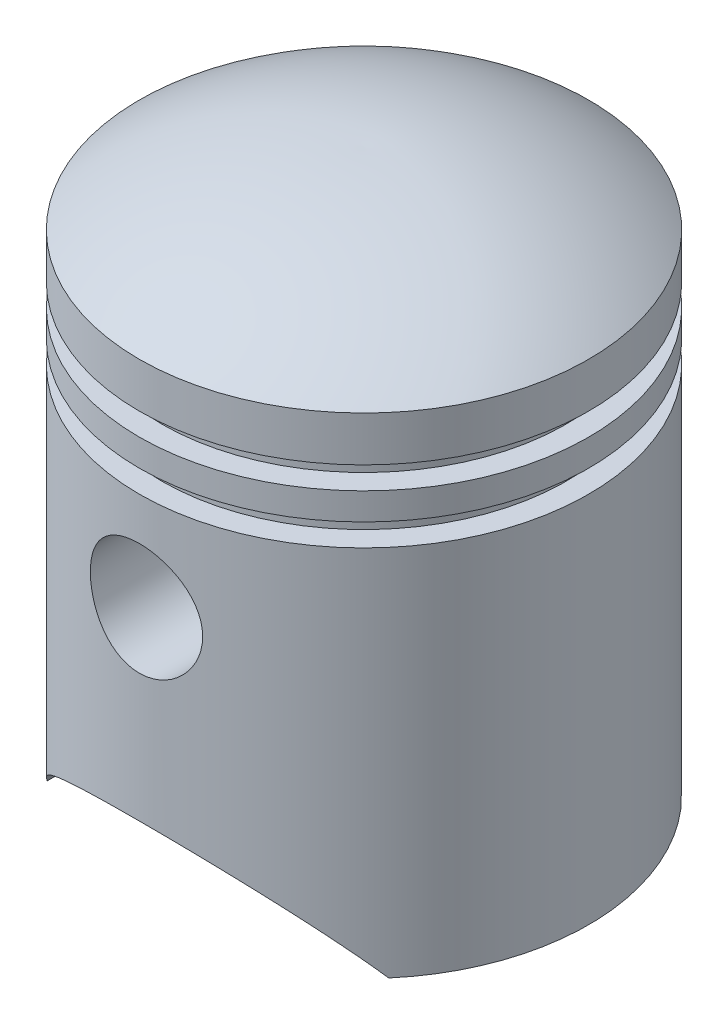
from build123d import *

# Parameters (mm, degrees)
CUT_EXTRUDE1_DEPTH       = 72.817566835
CUT_EXTRUDE1_DEPTH_BACK  = 72.817566835
SKETCH2_R                = 6.25
BOSS_EXTRUDE2_REACH      = 85.818
BOSS_EXTRUDE2_END_RADIUS = 23
BOSS_EXTRUDE2_START      = 12
SKETCH3_R                = 7.25
SKETCH3_R_2              = 6.25


with BuildPart() as part:
    # Sketch1 → Revolve1 (revolve)
    with BuildSketch(Plane.XY, mode=Mode.PRIVATE) as revolve1_sk:
        with BuildLine():
            Line((25, 0), (25, 41.5))
            Line((25, 41.5), (22.5, 41.5))
            Line((22.5, 41.5), (22.5, 44))
            Line((22.5, 44), (25, 44))
            Line((25, 44), (25, 47))
            Line((25, 47), (22.5, 47))
            Line((22.5, 47), (22.5, 49.5))
            Line((22.5, 49.5), (25, 49.5))
            Line((25, 49.5), (25, 54.5))
            ThreePointArc((25, 54.5), (13.174901691, 60.609067785), (0, 62.5))
            Line((0, 62.5), (0, 60.49936285))
            ThreePointArc((0, 60.49936285), (12.069492637, 58.859165445), (23, 53.484511145))
            Line((23, 53.484511145), (23, 51.5))
            Line((23, 51.5), (20.5, 51.5))
            Line((20.5, 51.5), (20.5, 45.5))
            Line((20.5, 45.5), (20.5, 39.5))
            Line((20.5, 39.5), (23, 39.5))
            Line((23, 39.5), (23, 0))
            Line((23, 0), (25, 0))
        make_face()
    revolve(revolve1_sk.sketch.rotate(Axis((0, 94.009961237, 0), (0, -1, 0)), 90), axis=Axis((0, 94.009961237, 0), (0, -1, 0)))

    # Sketch2 → Cut-Extrude1 (cut, two sides: drawn at the far end of the back side and taken through both)
    with BuildSketch(Plane.XY.offset(-CUT_EXTRUDE1_DEPTH_BACK)):
        with Locations((0, 30.5)):
            Circle(SKETCH2_R)
        with BuildLine():
            Line((-19, 0), (19, 0))
            ThreePointArc((19, 0), (0, 10), (-19, 0))
        make_face()
    extrude(amount=CUT_EXTRUDE1_DEPTH + CUT_EXTRUDE1_DEPTH_BACK, mode=Mode.SUBTRACT)

    # Boss-Extrude2: up to this cylinder (the profile starts inside it)
    boss_extrude2_end = Plane(origin=(0, 23.455061, 0), z_dir=(0, 1, 0)) * Cylinder(BOSS_EXTRUDE2_END_RADIUS, 218.636, mode=Mode.PRIVATE)
    # Sketch3 → Boss-Extrude2 (add, up to the surface)
    with BuildSketch(Plane.XY.offset(BOSS_EXTRUDE2_START), mode=Mode.PRIVATE) as boss_extrude2_sk1:
        with Locations(Location((0, 30.5, 0), (0, 0, 90))):
            Circle(SKETCH3_R)
        with Locations((0, 30.5)):
            Circle(SKETCH3_R_2, mode=Mode.SUBTRACT)
    boss_extrude2_tool1 = extrude(boss_extrude2_sk1.sketch, amount=BOSS_EXTRUDE2_REACH, mode=Mode.PRIVATE) & boss_extrude2_end
    boss_extrude2 = boss_extrude2_tool1.solids().sort_by_distance((0, 23.455061, 12))[0]
    add(boss_extrude2)

    # Mirror1: Boss-Extrude2 across plane
    add(boss_extrude2.mirror(Plane.XY))


solid = part.part
